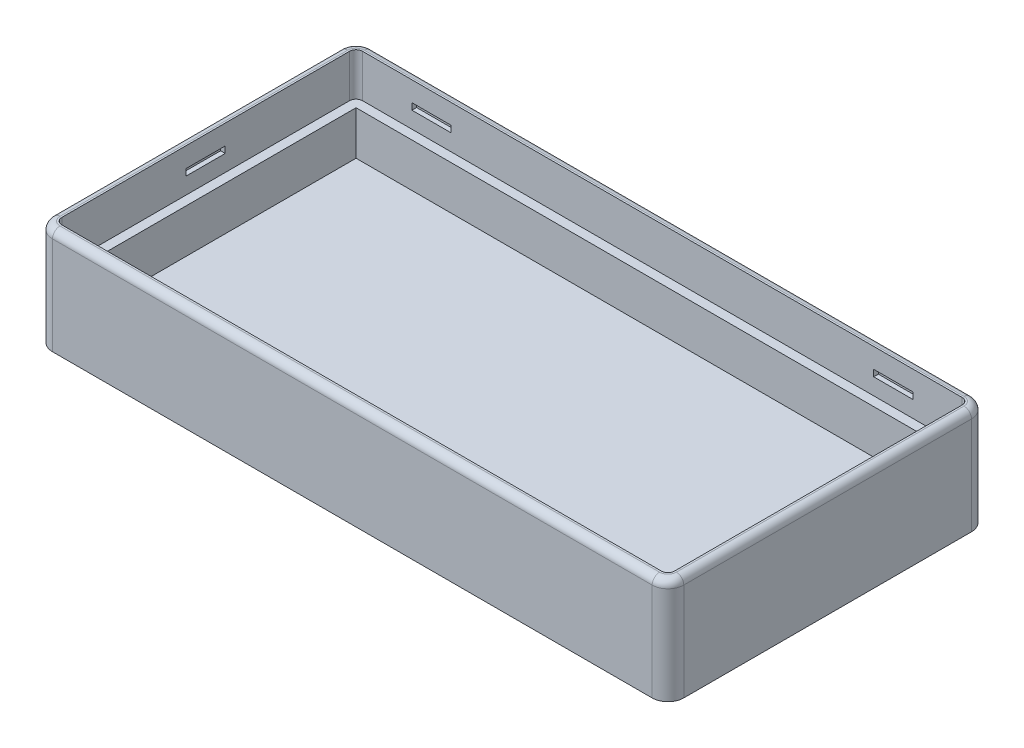
from build123d import *

# Parameters (mm, degrees)
EXTRUDE_1_DEPTH     = 11.3
CUT_EXTRUDE_1_DEPTH = 4.6
SKETCH_3_W          = 63.8
SKETCH_3_H          = 30.3
CUT_EXTRUDE_2_DEPTH = 4.7
SKETCH_4_W          = 4.2
SKETCH_4_H          = 0.7
CUT_EXTRUDE_3_DEPTH = 0.5
SKETCH_5_W          = 4.2
SKETCH_5_H          = 0.7
CUT_EXTRUDE_4_DEPTH = 0.5
FILLET_4_R          = 0.8


with BuildPart() as part:
    # 草图1 → 凸台-拉伸1 (new body)
    with BuildSketch(Plane(origin=(0, 0, 0), x_dir=(1, 0, 0), z_dir=(0, 1, 0))):
        with BuildLine():
            Line((-32.2, 17.15), (32.2, 17.15))
            ThreePointArc((32.2, 17.15), (33.402081528, 16.652081528), (33.9, 15.45))
            Line((33.9, 15.45), (33.9, -15.45))
            ThreePointArc((33.9, -15.45), (33.402081528, -16.652081528), (32.2, -17.15))
            Line((32.2, -17.15), (-32.2, -17.15))
            ThreePointArc((-32.2, -17.15), (-33.402081528, -16.652081528), (-33.9, -15.45))
            Line((-33.9, -15.45), (-33.9, 15.45))
            ThreePointArc((-33.9, 15.45), (-33.402081528, 16.652081528), (-32.2, 17.15))
        make_face()
    extrude(amount=EXTRUDE_1_DEPTH)

    # 草图2 → 切除-拉伸1 (cut)
    with BuildSketch(Plane(origin=(0, 11.3, 0), x_dir=(1, 0, 0), z_dir=(0, 1, 0))):
        with BuildLine():
            Line((32.9, -15.45), (32.9, 15.45))
            ThreePointArc((32.9, 15.45), (32.694974747, 15.944974747), (32.2, 16.15))
            Line((32.2, 16.15), (-32.2, 16.15))
            ThreePointArc((-32.2, 16.15), (-32.694974747, 15.944974747), (-32.9, 15.45))
            Line((-32.9, 15.45), (-32.9, -15.45))
            ThreePointArc((-32.9, -15.45), (-32.694974747, -15.944974747), (-32.2, -16.15))
            Line((-32.2, -16.15), (32.2, -16.15))
            ThreePointArc((32.2, -16.15), (32.694974747, -15.944974747), (32.9, -15.45))
        make_face()
    extrude(amount=-CUT_EXTRUDE_1_DEPTH, mode=Mode.SUBTRACT)

    # 草图3 → 切除-拉伸2 (cut)
    with BuildSketch(Plane(origin=(0, 6.7, 0), x_dir=(1, 0, 0), z_dir=(0, 1, 0))):
        Rectangle(SKETCH_3_W, SKETCH_3_H)
    extrude(amount=-CUT_EXTRUDE_2_DEPTH, mode=Mode.SUBTRACT)

    # 草图4 → 切除-拉伸3 (cut)
    with BuildSketch(Plane(origin=(-32.9, 0, 0), x_dir=(0, 0, -1), z_dir=(1, 0, 0))):
        with Locations((0, 8.82)):
            Rectangle(SKETCH_4_W, SKETCH_4_H)
    cut_extrude_3 = extrude(amount=-CUT_EXTRUDE_3_DEPTH, mode=Mode.SUBTRACT)

    # 镜向1: 切除-拉伸3 across plane
    add(cut_extrude_3.mirror(Plane(origin=(0, 0, 0), x_dir=(0, 0, 1), z_dir=(1, 0, 0))), mode=Mode.SUBTRACT)

    # 草图5 → 切除-拉伸4 (cut)
    with BuildSketch(Plane(origin=(0, 0, 16.15), x_dir=(-1, 0, 0), z_dir=(0, 0, -1))):
        with Locations((-24.8, 8.82)):
            Rectangle(SKETCH_5_W, SKETCH_5_H)
        with Locations((24.8, 8.82)):
            Rectangle(SKETCH_5_W, SKETCH_5_H)
    cut_extrude_4 = extrude(amount=-CUT_EXTRUDE_4_DEPTH, mode=Mode.SUBTRACT)

    # 镜向2: 切除-拉伸4 across plane
    add(cut_extrude_4.mirror(Plane.XY), mode=Mode.SUBTRACT)

    # 圆角4
    fillet_4_edges = [part.edges().sort_by_distance(p)[0] for p in [
        (-33.402081528, 11.3, -16.652081528),
        (-33.9, 11.3, 0),
        (-33.402081528, 11.3, 16.652081528),
        (0, 11.3, 17.15),
        (33.402081528, 11.3, 16.652081528),
        (33.9, 11.3, 0),
        (33.402081528, 11.3, -16.652081528),
        (0, 11.3, -17.15),
    ]]
    fillet(fillet_4_edges, radius=FILLET_4_R)


solid = part.part
